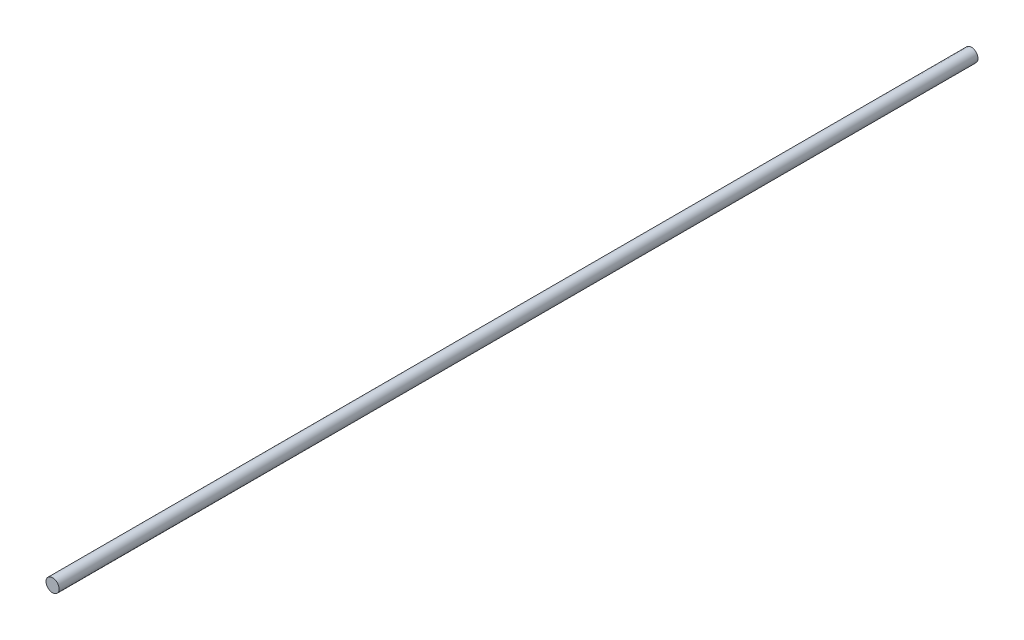
from build123d import *

# Parameters (mm, degrees)
ESQUISSE1_R        = 3
BOSS_EXTRU_1_DEPTH = 420


with BuildPart() as part:
    # Esquisse1 → Boss.-Extru.1 (new body)
    with BuildSketch(Plane.XY):
        Circle(ESQUISSE1_R)
    extrude(amount=BOSS_EXTRU_1_DEPTH)


solid = part.part
